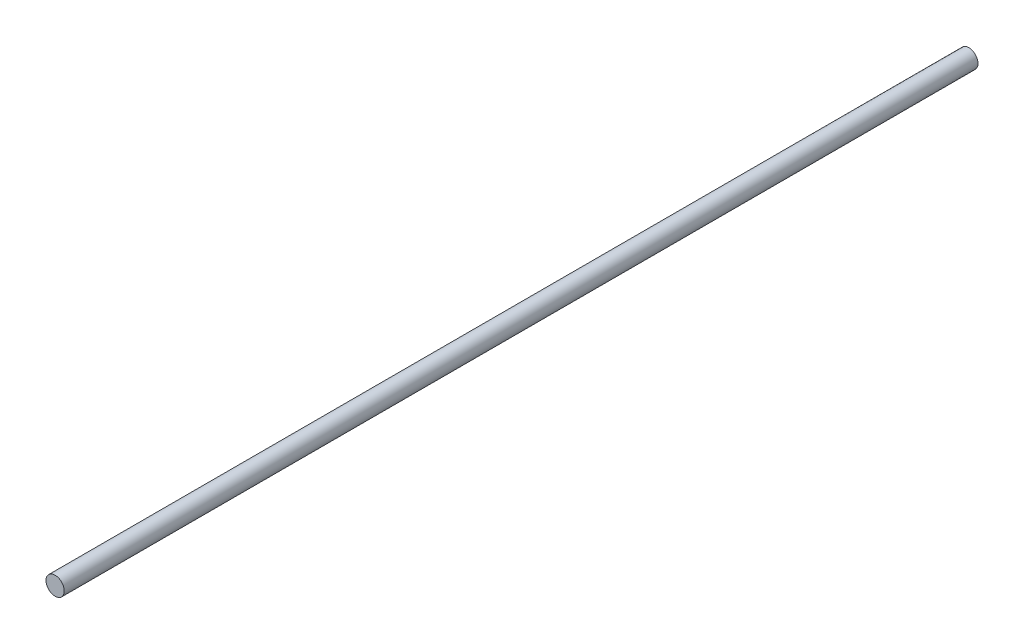
from build123d import *

# Parameters (mm, degrees)
ESBO_O1_R                = 4
RESSALTO_EXTRUS_O1_DEPTH = 400


with BuildPart() as part:
    # Esboço1 → Ressalto-extrusão1 (new body)
    with BuildSketch(Plane.XY):
        Circle(ESBO_O1_R)
    extrude(amount=RESSALTO_EXTRUS_O1_DEPTH)


solid = part.part
